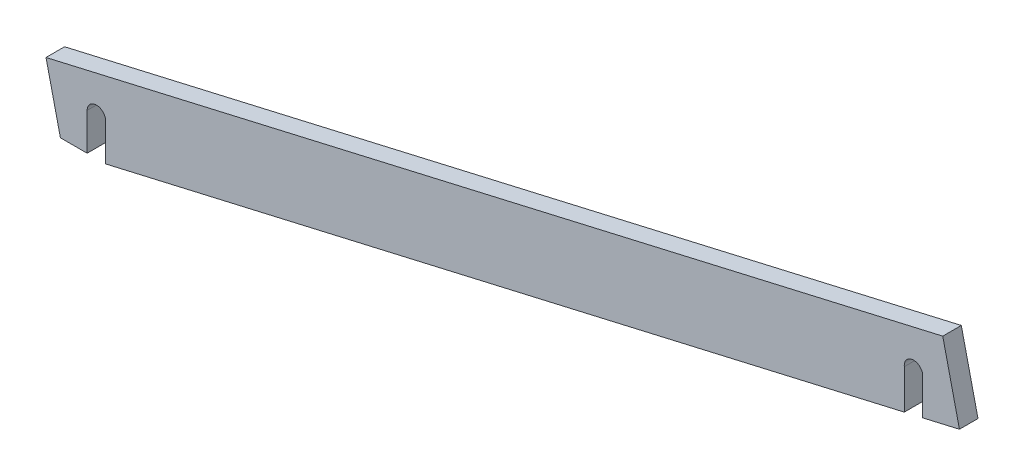
from build123d import *

# Parameters (mm, degrees)
BOSS_EXTRUDE1_DEPTH = 1.5875


with BuildPart() as part:
    # Sketch1 → Boss-Extrude1 (new body)
    with BuildSketch(Plane.XY):
        with BuildLine():
            Line((0, 0), (0, 3.175))
            ThreePointArc((0, 3.175), (0.79375, 3.96875), (1.5875, 3.175))
            Line((1.5875, 3.175), (1.5875, 0))
            Line((1.5875, 0), (69.9135, 15.774300027))
            Line((69.9135, 15.774300027), (69.9135, 19.146896146))
            ThreePointArc((69.9135, 19.146896146), (70.619414052, 20.019686772), (71.492204678, 19.31377272))
            Line((71.492204678, 19.31377272), (71.492204678, 16.13877272))
            Line((71.492204678, 16.13877272), (74.631909532, 16.8636307))
            Line((74.631909532, 16.8636307), (73.203470337, 23.050880612))
            Line((73.203470337, 23.050880612), (1.5875, 6.517031084))
            Line((1.5875, 6.517031084), (-3.518428564, 5.338234593))
            Line((-3.518428564, 5.338234593), (-2.286, 0))
            Line((-2.286, 0), (0, 0))
        make_face()
    extrude(amount=BOSS_EXTRUDE1_DEPTH)


solid = part.part
